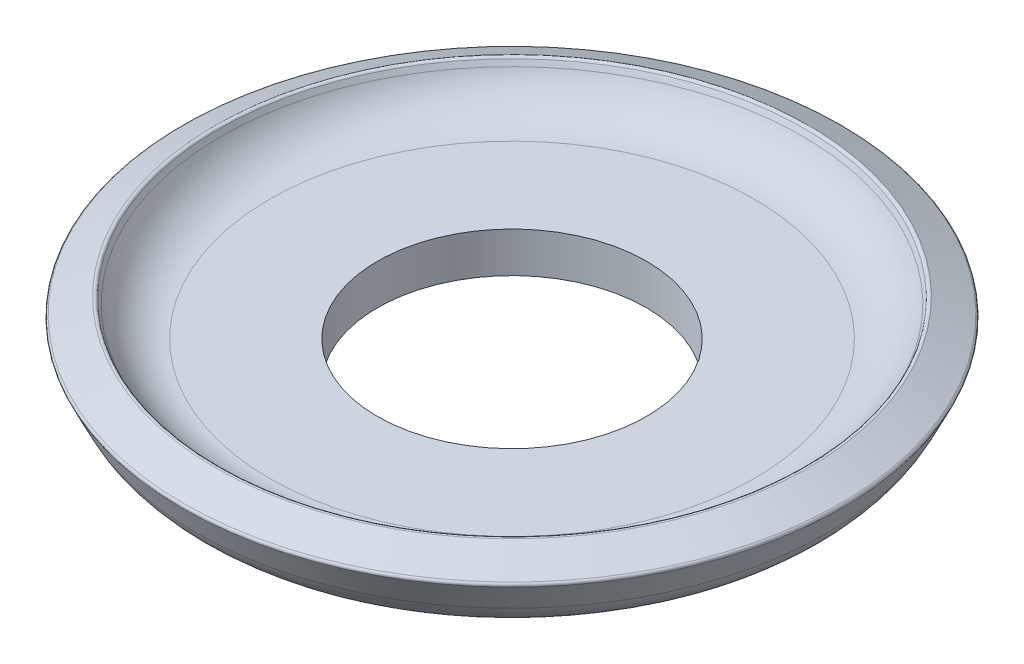
from build123d import *


with BuildPart() as part:
    # Sketch1 → Revolve1 (revolve)
    with BuildSketch(Plane.XY, mode=Mode.PRIVATE) as revolve1_sk:
        with BuildLine():
            Line((5, 1.176406116), (9.93722571, 1.176406116))
            ThreePointArc((9.93722571, 1.176406116), (10.997892387, 1.480827689), (11.735669245, 2.301419916))
            Line((11.735669245, 2.301419916), (12.23830631, 3.334538358))
            ThreePointArc((12.23830631, 3.334538358), (12.242904148, 3.410936815), (12.192133443, 3.468209845))
            Line((12.192133443, 3.468209845), (11.023145145, 4.036950875))
            ThreePointArc((11.023145145, 4.036950875), (10.946746688, 4.041548713), (10.889473658, 3.990778008))
            Line((10.889473658, 3.990778008), (10.797346375, 3.801419916))
            ThreePointArc((10.797346375, 3.801419916), (10.059569517, 2.980827689), (8.99890284, 2.676406116))
            Line((8.99890284, 2.676406116), (5, 2.676406116))
            Line((5, 2.676406116), (5, 1.176406116))
        make_face()
    revolve(revolve1_sk.sketch.rotate(Axis((0, 4.371150449, 0), (0, -1, 0)), 90), axis=Axis((0, 4.371150449, 0), (0, -1, 0)))


solid = part.part
